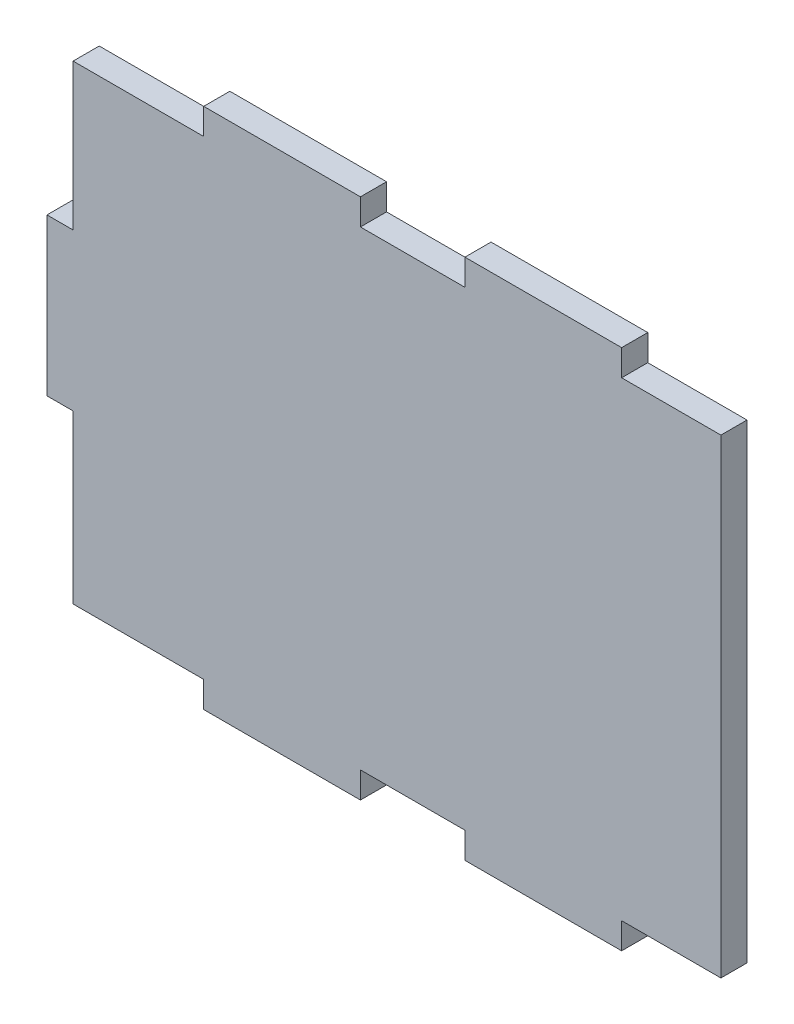
from build123d import *

# Parameters (mm, degrees)
BOSS_EXTRUDE1_DEPTH = 5


with BuildPart() as part:
    # Sketch1 → Boss-Extrude1 (new body)
    with BuildSketch(Plane.XY):
        Polygon((-69, 245), (-69, 250), (-99, 250), (-99, 245), (-124, 245), (-124, 217), (-129, 217), (-129, 187), (-124, 187), (-124, 155), (-99, 155), (-99, 150), (-69, 150), (-69, 155), (-49, 155), (-49, 150), (-19, 150), (-19, 155), (0, 155), (0, 245), (-19, 245), (-19, 250), (-49, 250), (-49, 245), align=None)
    extrude(amount=BOSS_EXTRUDE1_DEPTH)


solid = part.part
